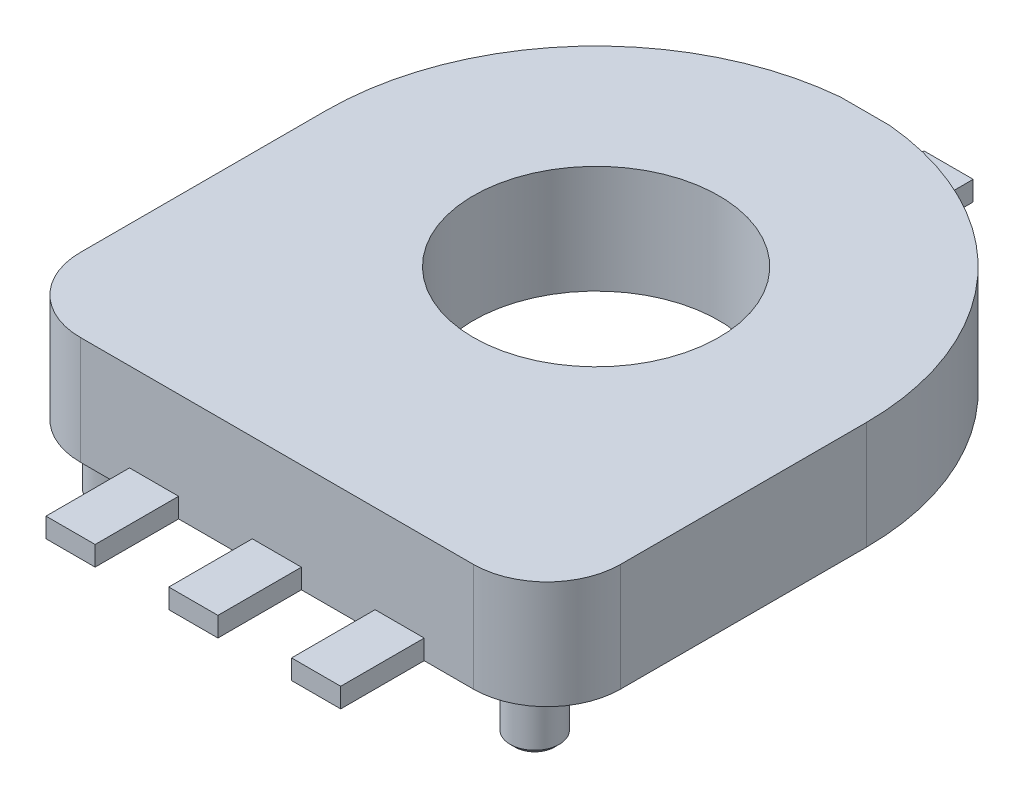
from build123d import *

# Parameters (mm, degrees)
SKETCH_1_R          = 2.5
SKETCH_1_W          = 1
SKETCH_1_H          = 1.7
EXTRUDE_1_DEPTH     = 1.1
SKETCH_2_W          = 1
SKETCH_2_H          = 1.7
CUT_EXTRUDE_1_DEPTH = 1.8
SKETCH_3_R          = 0.5
EXTRUDE_2_DEPTH     = 1.2
CHAMFER_1_SIZE      = 0.1


with BuildPart() as part:
    # 草图1 → 凸台-拉伸1 (new, symmetric)
    # profile 1 of 5: a face of its own
    with BuildSketch(Plane(origin=(0, 0, 0), x_dir=(1, 0, 0), z_dir=(0, 1, 0))):
        with BuildLine():
            Line((0, 1.5), (0, 6.5))
            ThreePointArc((0, 6.5), (5.5, 12), (11, 6.5))
            Line((11, 6.5), (11, 1.5))
            ThreePointArc((11, 1.5), (10.560660172, 0.439339828), (9.5, 0))
            Line((9.5, 0), (1.5, 0))
            ThreePointArc((1.5, 0), (0.439339828, 0.439339828), (0, 1.5))
        make_face()
        with Locations(Location((5.5, 6.5, 0), (0, 0, 270))):
            Circle(SKETCH_1_R, mode=Mode.SUBTRACT)
    # profile 2 of 5: a face of its own
    with BuildSketch(Plane(origin=(0, 0, 0), x_dir=(1, 0, 0), z_dir=(0, 1, 0))):
        with Locations((3, -0.85)):
            Rectangle(SKETCH_1_W, SKETCH_1_H)
    # profile 3 of 5: a face of its own
    with BuildSketch(Plane(origin=(0, 0, 0), x_dir=(1, 0, 0), z_dir=(0, 1, 0))):
        with Locations((5.5, -0.85)):
            Rectangle(SKETCH_1_W, SKETCH_1_H)
    # profile 4 of 5: a face of its own
    with BuildSketch(Plane(origin=(0, 0, 0), x_dir=(1, 0, 0), z_dir=(0, 1, 0))):
        with Locations((8, -0.85)):
            Rectangle(SKETCH_1_W, SKETCH_1_H)
    # profile 5 of 5: a face of its own
    with BuildSketch(Plane(origin=(0, 0, 0), x_dir=(1, 0, 0), z_dir=(0, 1, 0))):
        with Locations((5.5, 12.827225575)):
            Rectangle(SKETCH_1_W, SKETCH_1_H)
    extrude(amount=EXTRUDE_1_DEPTH, both=True)

    # 草图2 → 切除-拉伸1 (cut)
    with BuildSketch(Plane(origin=(0, 1.1, 0), x_dir=(1, 0, 0), z_dir=(0, 1, 0))):
        with Locations((5.5, 12.827225575)):
            Rectangle(SKETCH_2_W, SKETCH_2_H)
        with Locations((3, -0.85)):
            Rectangle(SKETCH_2_W, SKETCH_2_H)
        with Locations((5.5, -0.85)):
            Rectangle(SKETCH_2_W, SKETCH_2_H)
        with Locations((8, -0.85)):
            Rectangle(SKETCH_2_W, SKETCH_2_H)
    extrude(amount=-CUT_EXTRUDE_1_DEPTH, mode=Mode.SUBTRACT)

    # 草图3 → 凸台-拉伸2 (add)
    with BuildSketch(Plane.XZ.offset(1.1)):
        with Locations(Location((1.25, -1, 0), (0, 0, 90))):
            Circle(SKETCH_3_R)
        with Locations(Location((9.75, -1, 0), (0, 0, 90))):
            Circle(SKETCH_3_R)
    extrude(amount=EXTRUDE_2_DEPTH)

    # 倒角1
    chamfer_1_edges = [part.edges().sort_by_distance(p)[0] for p in [
        (1.25, -2.3, -1.5),
        (9.75, -2.3, -1.5),
    ]]
    chamfer(chamfer_1_edges, length=CHAMFER_1_SIZE)


solid = part.part
